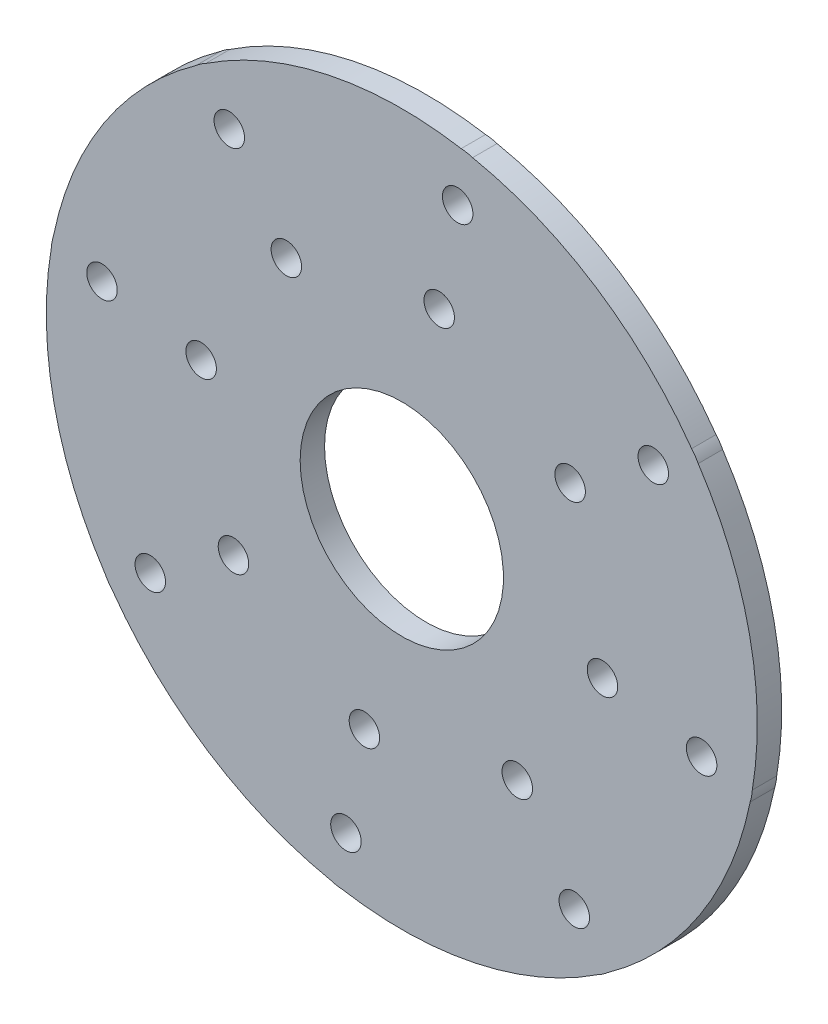
from build123d import *

# Parameters (mm, degrees)
SKETCH1_R           = 0.47625
SKETCH1_R_2         = 3.175
BOSS_EXTRUDE1_DEPTH = 0.762
BOSS_EXTRUDE2_START = -0.762
SKETCH2_R           = 11.103539479
BOSS_EXTRUDE2_DEPTH = 0.762


with BuildPart() as part:
    # Sketch1 → Boss-Extrude1 (new body)
    with BuildSketch(Plane.XY):
        with BuildLine():
            ThreePointArc((-2.039848362, 9.751221095), (-4.130378192, 9.88369568), (-6.129577027, 9.25834098))
            ThreePointArc((-6.129577027, 9.25834098), (-6.747337126, 8.674137968), (-6.975028685, 7.854944918))
            ThreePointArc((-6.975028685, 7.854944918), (-7.339372349, 6.47410056), (-8.33754517, 5.452763952))
            ThreePointArc((-8.33754517, 5.452763952), (-9.909445645, 4.068211113), (-10.880900197, 2.212373372))
            ThreePointArc((-10.880900197, 2.212373372), (-10.904630014, 1.362455548), (-10.4863749, 0.622194736))
            ThreePointArc((-10.4863749, 0.622194736), (-9.767600366, -0.61183955), (-9.751221095, -2.039848362))
            ThreePointArc((-9.751221095, -2.039848362), (-9.883695679, -4.130378205), (-9.258340968, -6.129577051))
            ThreePointArc((-9.258340968, -6.129577051), (-8.674137957, -6.747337133), (-7.854944918, -6.975028685))
            ThreePointArc((-7.854944918, -6.975028685), (-6.47410056, -7.339372349), (-5.452763952, -8.33754517))
            ThreePointArc((-5.452763952, -8.33754517), (-4.068210251, -9.909446321), (-2.212371278, -10.880900842))
            ThreePointArc((-2.212371278, -10.880900842), (-1.362454485, -10.90462975), (-0.622194736, -10.4863749))
            ThreePointArc((-0.622194736, -10.4863749), (0.61183955, -9.767600366), (2.039848362, -9.751221095))
            ThreePointArc((2.039848362, -9.751221095), (4.130377433, -9.883695772), (6.129575677, -9.258341694))
            ThreePointArc((6.129575677, -9.258341694), (6.747336732, -8.674138622), (6.975028685, -7.854944918))
            ThreePointArc((6.975028685, -7.854944918), (7.339372349, -6.47410056), (8.33754517, -5.452763952))
            ThreePointArc((8.33754517, -5.452763952), (9.909446191, -4.068210417), (10.880900717, -2.212371682))
            ThreePointArc((10.880900717, -2.212371682), (10.904629801, -1.36245469), (10.4863749, -0.622194736))
            ThreePointArc((10.4863749, -0.622194736), (9.767600366, 0.61183955), (9.751221095, 2.039848362))
            ThreePointArc((9.751221095, 2.039848362), (9.883695769, 4.130377457), (9.258341673, 6.129575719))
            ThreePointArc((9.258341673, 6.129575719), (8.674138602, 6.747336744), (7.854944918, 6.975028685))
            ThreePointArc((7.854944918, 6.975028685), (6.47410056, 7.339372349), (5.452763952, 8.33754517))
            ThreePointArc((5.452763952, 8.33754517), (4.068210359, 9.909446236), (2.212371542, 10.880900761))
            ThreePointArc((2.212371542, 10.880900761), (1.362454619, 10.904629783), (0.622194736, 10.4863749))
            ThreePointArc((0.622194736, 10.4863749), (-0.61183955, 9.767600366), (-2.039848362, 9.751221095))
        make_face()
        with Locations((-7.854944918, -5.387528685)):
            Circle(SKETCH1_R, mode=Mode.SUBTRACT)
        with Locations((-1.167787514, -6.267444918)):
            Circle(SKETCH1_R, mode=Mode.SUBTRACT)
        with Locations((-5.257503273, -3.606002332)):
            Circle(SKETCH1_R, mode=Mode.SUBTRACT)
        with Locations(Location((0, 0, 0), (0, 0, 180))):
            Circle(SKETCH1_R_2, mode=Mode.SUBTRACT)
        with Locations((3.606002332, -5.257503273)):
            Circle(SKETCH1_R, mode=Mode.SUBTRACT)
        with Locations((5.387528685, -7.854944918)):
            Circle(SKETCH1_R, mode=Mode.SUBTRACT)
        with Locations((9.363842884, -1.744726751)):
            Circle(SKETCH1_R, mode=Mode.SUBTRACT)
        with Locations((6.267444918, -1.167787514)):
            Circle(SKETCH1_R, mode=Mode.SUBTRACT)
        with Locations((-9.363842884, 1.744726751)):
            Circle(SKETCH1_R, mode=Mode.SUBTRACT)
        with Locations((-6.267444918, 1.167787514)):
            Circle(SKETCH1_R, mode=Mode.SUBTRACT)
        with Locations((-3.606002332, 5.257503273)):
            Circle(SKETCH1_R, mode=Mode.SUBTRACT)
        with Locations((-5.387528685, 7.854944918)):
            Circle(SKETCH1_R, mode=Mode.SUBTRACT)
        with Locations((5.257503273, 3.606002332)):
            Circle(SKETCH1_R, mode=Mode.SUBTRACT)
        with BuildLine():
            ThreePointArc((1.255023852, 6.735637063), (1.635979659, 6.180208581), (1.080551177, 5.799252774))
            ThreePointArc((1.080551177, 5.799252774), (0.69959537, 6.354681256), (1.255023852, 6.735637063))
        make_face(mode=Mode.SUBTRACT)
        with Locations((1.744726751, 9.363842884)):
            Circle(SKETCH1_R, mode=Mode.SUBTRACT)
        with Locations((7.854944918, 5.387528685)):
            Circle(SKETCH1_R, mode=Mode.SUBTRACT)
        with Locations((-1.744726751, -9.363842884)):
            Circle(SKETCH1_R, mode=Mode.SUBTRACT)
    extrude(amount=BOSS_EXTRUDE1_DEPTH)

    # Sketch2 → Boss-Extrude2 (add)
    with BuildSketch(Plane.XY.offset(0.762).offset(BOSS_EXTRUDE2_START)):
        Circle(SKETCH2_R)
        with BuildLine():
            ThreePointArc((8.267572946, 5.149721676), (9.364843608, 2.67807766), (9.740246185, 0))
            ThreePointArc((9.740246185, 0), (9.716357017, -0.681763934), (9.644806696, -1.360183646))
            ThreePointArc((9.644806696, -1.360183646), (9.788473946, -1.529082312), (9.840092885, -1.744726751))
            ThreePointArc((9.840092885, -1.744726751), (9.741789124, -2.034503739), (9.487460012, -2.204653776))
            ThreePointArc((9.487460012, -2.204653776), (8.163793491, -5.312708498), (5.858113138, -7.781703297))
            ThreePointArc((5.858113138, -7.781703297), (5.862360186, -7.818214708), (5.863778685, -7.854944918))
            ThreePointArc((5.863778685, -7.854944918), (5.625812627, -8.267297711), (5.149721676, -8.267572946))
            ThreePointArc((5.149721676, -8.267572946), (2.016021533, -9.529325943), (-1.360183646, -9.644806696))
            ThreePointArc((-1.360183646, -9.644806696), (-1.831963088, -9.832035029), (-2.204653776, -9.487460012))
            ThreePointArc((-2.204653776, -9.487460012), (-5.312708498, -8.163793491), (-7.781703297, -5.858113138))
            ThreePointArc((-7.781703297, -5.858113138), (-8.247692164, -5.656905119), (-8.267572946, -5.149721676))
            ThreePointArc((-8.267572946, -5.149721676), (-9.529325943, -2.016021533), (-9.644806696, 1.360183646))
            ThreePointArc((-9.644806696, 1.360183646), (-9.832035029, 1.831963088), (-9.487460012, 2.204653776))
            ThreePointArc((-9.487460012, 2.204653776), (-8.163793491, 5.312708498), (-5.858113138, 7.781703297))
            ThreePointArc((-5.858113138, 7.781703297), (-5.656905119, 8.247692164), (-5.149721676, 8.267572946))
            ThreePointArc((-5.149721676, 8.267572946), (-2.016021533, 9.529325943), (1.360183646, 9.644806696))
            ThreePointArc((1.360183646, 9.644806696), (1.831963088, 9.832035029), (2.204653776, 9.487460012))
            ThreePointArc((2.204653776, 9.487460012), (5.312708498, 8.163793491), (7.781703297, 5.858113138))
            ThreePointArc((7.781703297, 5.858113138), (8.164729311, 5.74925744), (8.331194918, 5.387528685))
            ThreePointArc((8.331194918, 5.387528685), (8.315014565, 5.264443421), (8.267572946, 5.149721676))
        make_face(mode=Mode.SUBTRACT)
    extrude(amount=BOSS_EXTRUDE2_DEPTH)


solid = part.part
